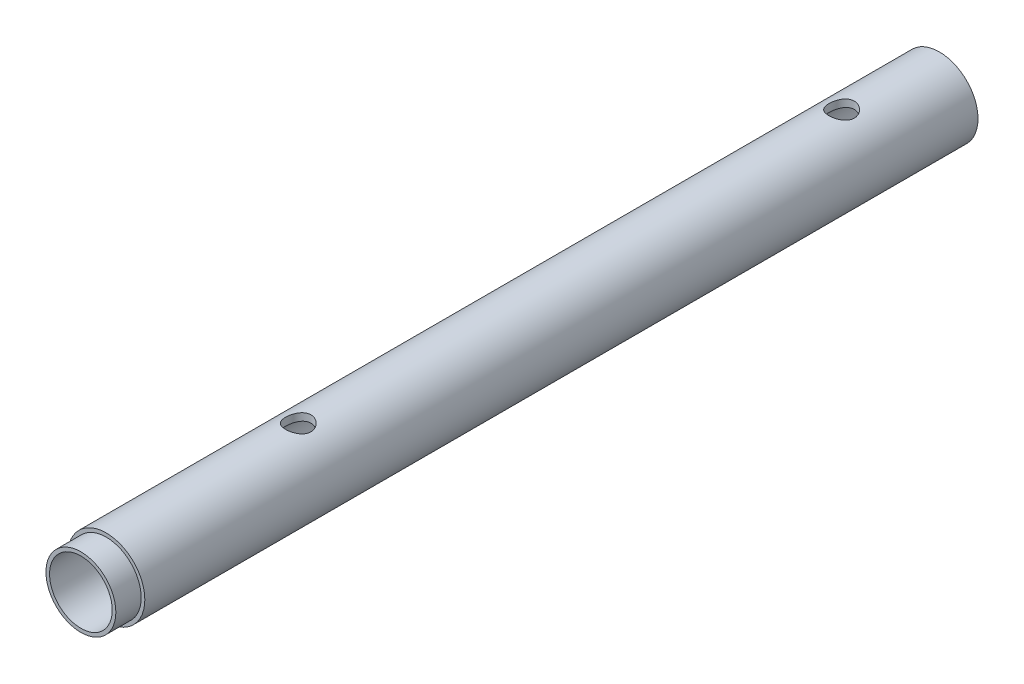
from build123d import *

# Parameters (mm, degrees)
SKETCH1_R           = 10.65
SKETCH1_R_2         = 8.65
BOSS_EXTRUDE1_DEPTH = 237
SKETCH2_R           = 3.5
CUT_EXTRUDE1_DEPTH  = 238.478093727
LPATTERN1_COUNT     = 2
LPATTERN1_PITCH     = 150
SKETCH3_W           = 1
SKETCH3_H           = 7


with BuildPart() as part:
    # Sketch1 → Boss-Extrude1 (new body)
    with BuildSketch(Plane.XY):
        Circle(SKETCH1_R)
        Circle(SKETCH1_R_2, mode=Mode.SUBTRACT)
    extrude(amount=BOSS_EXTRUDE1_DEPTH)

    # Sketch2 → Cut-Extrude1 (cut, symmetric)
    with BuildSketch(Plane(origin=(0, 0, 0), x_dir=(1, 0, 0), z_dir=(0, 1, 0))):
        with Locations(Location((0, -177, 0), (0, 0, 270))):
            Circle(SKETCH2_R)
    cut_extrude1 = extrude(amount=CUT_EXTRUDE1_DEPTH, both=True, mode=Mode.SUBTRACT)

    # LPattern1: Cut-Extrude1 ×2
    with Locations(*[(0, 0, -i * LPATTERN1_PITCH) for i in range(1, LPATTERN1_COUNT)]):
        add(cut_extrude1, mode=Mode.SUBTRACT)

    # Sketch3 → Cut-Revolve1 (revolve, cut)
    with BuildSketch(Plane(origin=(0, 0, 0), x_dir=(1, 0, 0), z_dir=(0, 1, 0)), mode=Mode.PRIVATE) as cut_revolve1_sk:
        with Locations((-10.15, -233.5)):
            Rectangle(SKETCH3_W, SKETCH3_H)
    revolve(cut_revolve1_sk.sketch.rotate(Axis((0, 0, 237), (0, 0, -1)), 180), axis=Axis((0, 0, 237), (0, 0, -1)), mode=Mode.SUBTRACT)


solid = part.part
